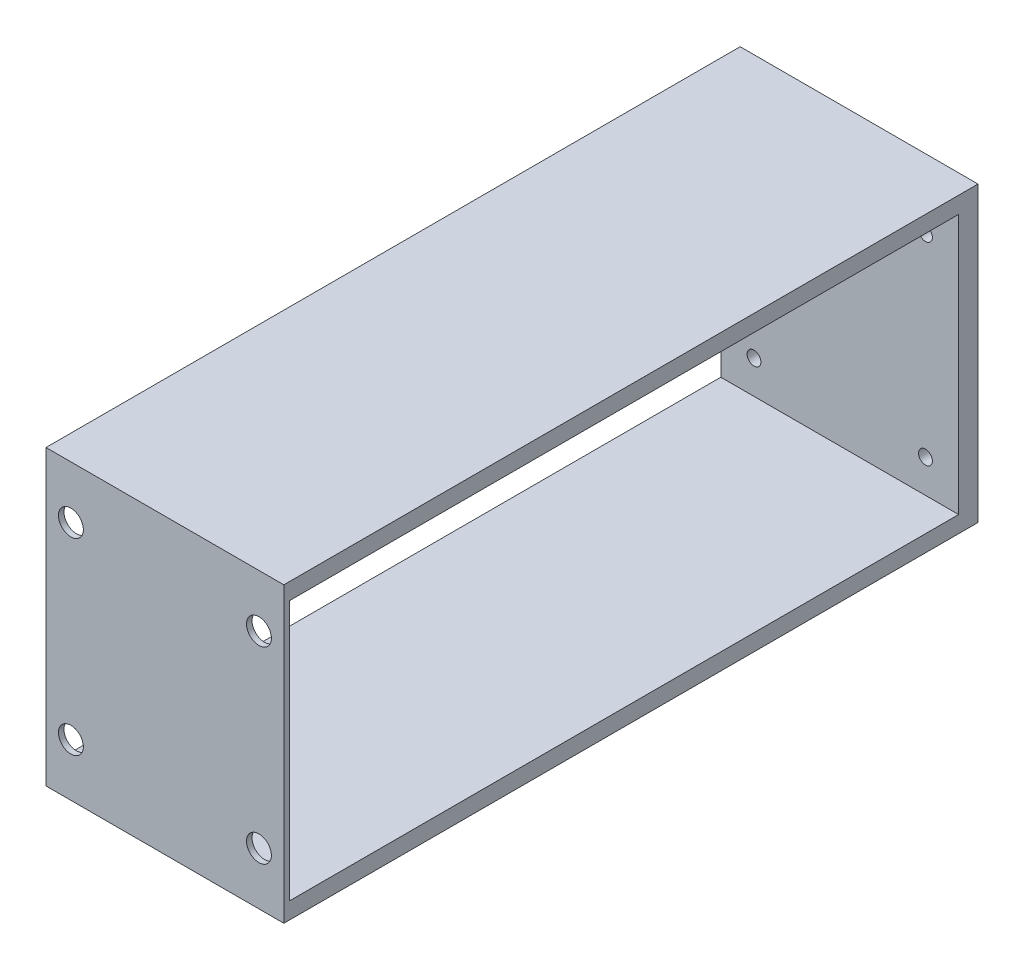
from build123d import *

# Parameters (mm, degrees)
SKETCH_1_W                  = 43
SKETCH_1_H                  = 47
EXTRUDE_1_DEPTH             = 1
SKETCH_2_W                  = 43
SKETCH_2_H                  = 122
EXTRUDE_2_DEPTH             = 3
SKETCH_3_W                  = 43
SKETCH_3_H                  = 122
EXTRUDE_3_DEPTH             = 3
SKETCH_5_R                  = 2.25
CUT_EXTRUDE_1_DEPTH         = 10
PATTERN_LINEAR_1_COUNT      = 2
PATTERN_LINEAR_1_PITCH      = 34
PATTERN_LINEAR_1_COUNT_DIR2 = 2
PATTERN_LINEAR_1_PITCH_DIR2 = 34
SKETCH_6_W                  = 43
SKETCH_6_H                  = 53
EXTRUDE_4_DEPTH             = 3.5
HOLE_WIZARD_M3_1_D          = 2.5
HOLE_WIZARD_M3_1_DEPTH      = 7.5
HOLE_WIZARD_M3_1_TIP        = 0.751075774


with BuildPart() as part:
    # 草图1 → 凸台-拉伸1 (new body)
    with BuildSketch(Plane.XY):
        Rectangle(SKETCH_1_W, SKETCH_1_H)
    extrude(amount=EXTRUDE_1_DEPTH)

    # 草图2 → 凸台-拉伸2 (add)
    with BuildSketch(Plane(origin=(0, 23.5, 0), x_dir=(1, 0, 0), z_dir=(0, 1, 0))):
        with Locations((0, 60)):
            Rectangle(SKETCH_2_W, SKETCH_2_H)
    extrude(amount=EXTRUDE_2_DEPTH)

    # 草图3 → 凸台-拉伸3 (add)
    with BuildSketch(Plane.XZ.offset(23.5)):
        with Locations((0, -60)):
            Rectangle(SKETCH_3_W, SKETCH_3_H)
    extrude(amount=EXTRUDE_3_DEPTH)

    # 草图5 → 切除-拉伸1 (cut)
    with BuildSketch(Plane.XY.offset(1)):
        with Locations((-17, -17)):
            Circle(SKETCH_5_R)
    cut_extrude_1 = extrude(amount=-CUT_EXTRUDE_1_DEPTH, mode=Mode.SUBTRACT)

    # 阵列(线性)1: Cut-Extrude 1 2 × 2
    with Locations(*[(j * PATTERN_LINEAR_1_PITCH_DIR2, i * PATTERN_LINEAR_1_PITCH, 0) for i in range(PATTERN_LINEAR_1_COUNT) for j in range(PATTERN_LINEAR_1_COUNT_DIR2) if (i, j) != (0, 0)]):
        add(cut_extrude_1, mode=Mode.SUBTRACT)

    # 草图6 → 凸台-拉伸4 (add)
    with BuildSketch(Plane(origin=(0, 0, -121), x_dir=(-1, 0, 0), z_dir=(0, 0, -1))):
        Rectangle(SKETCH_6_W, SKETCH_6_H)
    extrude(amount=EXTRUDE_4_DEPTH)

    # M3 螺纹孔1
    with Locations(Plane(origin=(-15.5, 17.5, -121), x_dir=(1, 0, 0), z_dir=(0, 0, 1))):
        with Locations((0, 0), (31, 0), (0, -35), (31, -35)):
            Hole(HOLE_WIZARD_M3_1_D / 2, depth=HOLE_WIZARD_M3_1_DEPTH)
            with Locations((0, 0, -(HOLE_WIZARD_M3_1_DEPTH + HOLE_WIZARD_M3_1_TIP / 2))):  # 118° drill point
                Cone(0, HOLE_WIZARD_M3_1_D / 2, HOLE_WIZARD_M3_1_TIP, mode=Mode.SUBTRACT)


solid = part.part
